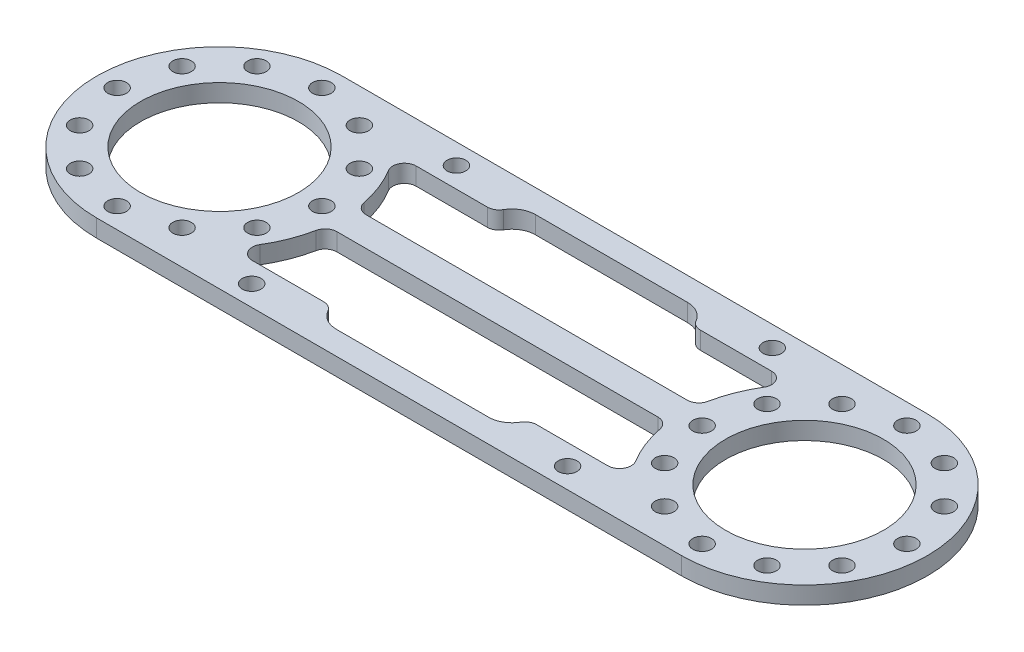
from build123d import *

# Parameters (mm, degrees)
SKETCH_1_R          = 13.5
SKETCH_1_R_2        = 1.6
EXTRUDE_1_DEPTH     = 3
CUT_EXTRUDE_START   = -10
CUT_EXTRUDE_1_DEPTH = 10
SKETCH_3_W          = 61.8
SKETCH_3_H          = 5
EXTRUDE_1_2_DEPTH   = 3
FILLET_1_R          = 2
SKETCH_6_W          = 26
SKETCH_6_H          = 5
CUT_EXTRUDE_2_DEPTH = 10
SKETCH_7_R          = 1.6
CUT_EXTRUDE_3_DEPTH = 10


with BuildPart() as part:
    # 草图1 → Extrude 1 (new body)
    with BuildSketch(Plane(origin=(0, 0, 0), x_dir=(1, 0, 0), z_dir=(0, 1, 0))):
        with BuildLine():
            Line((-50, 21), (50, 21))
            ThreePointArc((50, 21), (71, 0), (50, -21))
            Line((50, -21), (-50, -21))
            ThreePointArc((-50, -21), (-71, 0), (-50, 21))
        make_face()
        with Locations(Location((-50, 0, 0), (0, 0, 270))):
            Circle(SKETCH_1_R, mode=Mode.SUBTRACT)
        with Locations(Location((-50, 17.5, 0), (0, 0, 270))):
            Circle(SKETCH_1_R_2, mode=Mode.SUBTRACT)
        with Locations(Location((-13, 13, 0), (0, 0, 270))):
            Circle(SKETCH_1_R_2, mode=Mode.SUBTRACT)
        with Locations(Location((-13, -13, 0), (0, 0, 270))):
            Circle(SKETCH_1_R_2, mode=Mode.SUBTRACT)
        with Locations(Location((-41.25, 15.155444566, 0), (0, 0, 270))):
            Circle(SKETCH_1_R_2, mode=Mode.SUBTRACT)
        with Locations(Location((-34.844555434, 8.75, 0), (0, 0, 270))):
            Circle(SKETCH_1_R_2, mode=Mode.SUBTRACT)
        with Locations(Location((-32.5, 0, 0), (0, 0, 270))):
            Circle(SKETCH_1_R_2, mode=Mode.SUBTRACT)
        with Locations(Location((-34.844555434, -8.75, 0), (0, 0, 270))):
            Circle(SKETCH_1_R_2, mode=Mode.SUBTRACT)
        with Locations(Location((-41.25, -15.155444566, 0), (0, 0, 270))):
            Circle(SKETCH_1_R_2, mode=Mode.SUBTRACT)
        with Locations(Location((-50, -17.5, 0), (0, 0, 270))):
            Circle(SKETCH_1_R_2, mode=Mode.SUBTRACT)
        with Locations(Location((-58.75, -15.155444566, 0), (0, 0, 270))):
            Circle(SKETCH_1_R_2, mode=Mode.SUBTRACT)
        with Locations(Location((-65.155444566, -8.75, 0), (0, 0, 270))):
            Circle(SKETCH_1_R_2, mode=Mode.SUBTRACT)
        with Locations(Location((-67.5, 0, 0), (0, 0, 270))):
            Circle(SKETCH_1_R_2, mode=Mode.SUBTRACT)
        with Locations(Location((-65.155444566, 8.75, 0), (0, 0, 270))):
            Circle(SKETCH_1_R_2, mode=Mode.SUBTRACT)
        with Locations(Location((-58.75, 15.155444566, 0), (0, 0, 270))):
            Circle(SKETCH_1_R_2, mode=Mode.SUBTRACT)
        with Locations(Location((58.75, 15.155444566, 0), (0, 0, 270))):
            Circle(SKETCH_1_R_2, mode=Mode.SUBTRACT)
        with Locations(Location((65.155444566, 8.75, 0), (0, 0, 270))):
            Circle(SKETCH_1_R_2, mode=Mode.SUBTRACT)
        with Locations(Location((67.5, 0, 0), (0, 0, 270))):
            Circle(SKETCH_1_R_2, mode=Mode.SUBTRACT)
        with Locations(Location((65.155444566, -8.75, 0), (0, 0, 270))):
            Circle(SKETCH_1_R_2, mode=Mode.SUBTRACT)
        with Locations(Location((58.75, -15.155444566, 0), (0, 0, 270))):
            Circle(SKETCH_1_R_2, mode=Mode.SUBTRACT)
        with Locations(Location((50, -17.5, 0), (0, 0, 270))):
            Circle(SKETCH_1_R_2, mode=Mode.SUBTRACT)
        with Locations(Location((41.25, -15.155444566, 0), (0, 0, 270))):
            Circle(SKETCH_1_R_2, mode=Mode.SUBTRACT)
        with Locations(Location((34.844555434, -8.75, 0), (0, 0, 270))):
            Circle(SKETCH_1_R_2, mode=Mode.SUBTRACT)
        with Locations(Location((32.5, 0, 0), (0, 0, 270))):
            Circle(SKETCH_1_R_2, mode=Mode.SUBTRACT)
        with Locations(Location((41.25, 15.155444566, 0), (0, 0, 270))):
            Circle(SKETCH_1_R_2, mode=Mode.SUBTRACT)
        with Locations(Location((13, -13, 0), (0, 0, 270))):
            Circle(SKETCH_1_R_2, mode=Mode.SUBTRACT)
        with Locations(Location((13, 13, 0), (0, 0, 270))):
            Circle(SKETCH_1_R_2, mode=Mode.SUBTRACT)
        with Locations(Location((50, 17.5, 0), (0, 0, 270))):
            Circle(SKETCH_1_R_2, mode=Mode.SUBTRACT)
        with Locations(Location((50, 0, 0), (0, 0, 270))):
            Circle(SKETCH_1_R, mode=Mode.SUBTRACT)
        with Locations(Location((34.844555434, 8.75, 0), (0, 0, 270))):
            Circle(SKETCH_1_R_2, mode=Mode.SUBTRACT)
    extrude(amount=EXTRUDE_1_DEPTH)

    # 草图2 → 切除-拉伸1 (cut)
    with BuildSketch(Plane(origin=(0, 3, 0), x_dir=(1, 0, 0), z_dir=(0, 1, 0)).offset(CUT_EXTRUDE_START)):
        with BuildLine():
            Line((-16.872983346, 14), (-34.347524158, 14))
            ThreePointArc((-34.347524158, 14), (-30.382380462, 7.493263885), (-29, 0))
            ThreePointArc((-29, 0), (-30.382380462, -7.493263885), (-34.347524158, -14))
            Line((-34.347524158, -14), (-16.872983346, -14))
            ThreePointArc((-16.872983346, -14), (-13.50401717, -9.031881215), (-9, -13))
            ThreePointArc((-9, -13), (-9.031881215, -13.50401717), (-9.127016654, -14))
            Line((-9.127016654, -14), (9.127016654, -14))
            ThreePointArc((9.127016654, -14), (12.49598283, -9.031881215), (17, -13))
            ThreePointArc((17, -13), (16.968118785, -13.50401717), (16.872983346, -14))
            Line((16.872983346, -14), (34.347524158, -14))
            ThreePointArc((34.347524158, -14), (29, 0), (34.347524158, 14))
            Line((34.347524158, 14), (16.872983346, 14))
            ThreePointArc((16.872983346, 14), (16.968118785, 13.50401717), (17, 13))
            ThreePointArc((17, 13), (12.49598283, 9.031881215), (9.127016654, 14))
            Line((9.127016654, 14), (-9.127016654, 14))
            ThreePointArc((-9.127016654, 14), (-9.031881215, 13.50401717), (-9, 13))
            ThreePointArc((-9, 13), (-13.50401717, 9.031881215), (-16.872983346, 14))
        make_face()
        with BuildLine():
            ThreePointArc((-9, -13), (-13.50401717, -9.031881215), (-16.872983346, -14))
            Line((-16.872983346, -14), (-14.2489996, -14))
            ThreePointArc((-14.2489996, -14), (-13.529905954, -11.490298149), (-11.4, -13))
            ThreePointArc((-11.4, -13), (-11.490298149, -13.529905954), (-11.7510004, -14))
            Line((-11.7510004, -14), (-9.127016654, -14))
            ThreePointArc((-9.127016654, -14), (-9.031881215, -13.50401717), (-9, -13))
        make_face()
        with BuildLine():
            Line((-14.2489996, -14), (-16.872983346, -14))
            ThreePointArc((-16.872983346, -14), (-13, -17), (-9.127016654, -14))
            Line((-9.127016654, -14), (-11.7510004, -14))
            ThreePointArc((-11.7510004, -14), (-13, -14.6), (-14.2489996, -14))
        make_face()
        with BuildLine():
            ThreePointArc((17, -13), (12.49598283, -9.031881215), (9.127016654, -14))
            Line((9.127016654, -14), (11.7510004, -14))
            ThreePointArc((11.7510004, -14), (12.470094046, -11.490298149), (14.6, -13))
            ThreePointArc((14.6, -13), (14.509701851, -13.529905954), (14.2489996, -14))
            Line((14.2489996, -14), (16.872983346, -14))
            ThreePointArc((16.872983346, -14), (16.968118785, -13.50401717), (17, -13))
        make_face()
        with BuildLine():
            Line((11.7510004, -14), (9.127016654, -14))
            ThreePointArc((9.127016654, -14), (13, -17), (16.872983346, -14))
            Line((16.872983346, -14), (14.2489996, -14))
            ThreePointArc((14.2489996, -14), (13, -14.6), (11.7510004, -14))
        make_face()
        with BuildLine():
            ThreePointArc((-9.127016654, 14), (-13, 17), (-16.872983346, 14))
            Line((-16.872983346, 14), (-14.2489996, 14))
            ThreePointArc((-14.2489996, 14), (-13, 14.6), (-11.7510004, 14))
            Line((-11.7510004, 14), (-9.127016654, 14))
        make_face()
        with BuildLine():
            Line((-14.2489996, 14), (-16.872983346, 14))
            ThreePointArc((-16.872983346, 14), (-13.50401717, 9.031881215), (-9, 13))
            ThreePointArc((-9, 13), (-9.031881215, 13.50401717), (-9.127016654, 14))
            Line((-9.127016654, 14), (-11.7510004, 14))
            ThreePointArc((-11.7510004, 14), (-11.490298149, 13.529905954), (-11.4, 13))
            ThreePointArc((-11.4, 13), (-13.529905954, 11.490298149), (-14.2489996, 14))
        make_face()
        with BuildLine():
            ThreePointArc((16.872983346, 14), (13, 17), (9.127016654, 14))
            Line((9.127016654, 14), (11.7510004, 14))
            ThreePointArc((11.7510004, 14), (13, 14.6), (14.2489996, 14))
            Line((14.2489996, 14), (16.872983346, 14))
        make_face()
        with BuildLine():
            Line((11.7510004, 14), (9.127016654, 14))
            ThreePointArc((9.127016654, 14), (12.49598283, 9.031881215), (17, 13))
            ThreePointArc((17, 13), (16.968118785, 13.50401717), (16.872983346, 14))
            Line((16.872983346, 14), (14.2489996, 14))
            ThreePointArc((14.2489996, 14), (14.509701851, 13.529905954), (14.6, 13))
            ThreePointArc((14.6, 13), (12.470094046, 11.490298149), (11.7510004, 14))
        make_face()
    extrude(amount=CUT_EXTRUDE_1_DEPTH, mode=Mode.SUBTRACT)

    # 草图3 → Extrude 1 2 (add)
    with BuildSketch(Plane(origin=(0, 3, 0), x_dir=(1, 0, 0), z_dir=(0, 1, 0))):
        Rectangle(SKETCH_3_W, SKETCH_3_H)
    extrude(amount=-EXTRUDE_1_2_DEPTH)

    # 圆角1
    fillet_1_edges = [part.edges().sort_by_distance(p)[0] for p in [
        (-9.127016654, 1.5, 14),
        (-16.872983346, 1.5, 14),
        (-34.347524158, 1.5, 14),
        (-34.347524158, 1.5, -14),
        (-16.872983346, 1.5, -14),
        (-9.127016654, 1.5, -14),
        (9.127016654, 1.5, -14),
        (16.872983346, 1.5, -14),
        (34.347524158, 1.5, -14),
        (34.347524158, 1.5, 14),
        (16.872983346, 1.5, 14),
        (9.127016654, 1.5, 14),
        (29.149340538, 1.5, -2.5),
        (29.149340538, 1.5, 2.5),
        (-29.149340538, 1.5, -2.5),
        (-29.149340538, 1.5, 2.5),
    ]]
    fillet(fillet_1_edges, radius=FILLET_1_R)

    # 草图6 → 切除-拉伸2 (cut)
    with BuildSketch(Plane(origin=(0, 3, 0), x_dir=(1, 0, 0), z_dir=(0, 1, 0))):
        with Locations((0, -14.5)):
            Rectangle(SKETCH_6_W, SKETCH_6_H)
        with Locations((0, 14.5)):
            Rectangle(SKETCH_6_W, SKETCH_6_H)
    extrude(amount=-CUT_EXTRUDE_2_DEPTH, mode=Mode.SUBTRACT)

    # 草图7 → 切除-拉伸3 (cut)
    with BuildSketch(Plane(origin=(0, 3, 0), x_dir=(1, 0, 0), z_dir=(0, 1, 0))):
        with Locations(Location((27, -17.5, 0), (0, 0, 270))):
            Circle(SKETCH_7_R)
        with Locations(Location((27, 17.5, 0), (0, 0, 270))):
            Circle(SKETCH_7_R)
        with Locations(Location((-27, 17.5, 0), (0, 0, 270))):
            Circle(SKETCH_7_R)
        with Locations(Location((-27, -17.5, 0), (0, 0, 270))):
            Circle(SKETCH_7_R)
    extrude(amount=-CUT_EXTRUDE_3_DEPTH, mode=Mode.SUBTRACT)


solid = part.part
